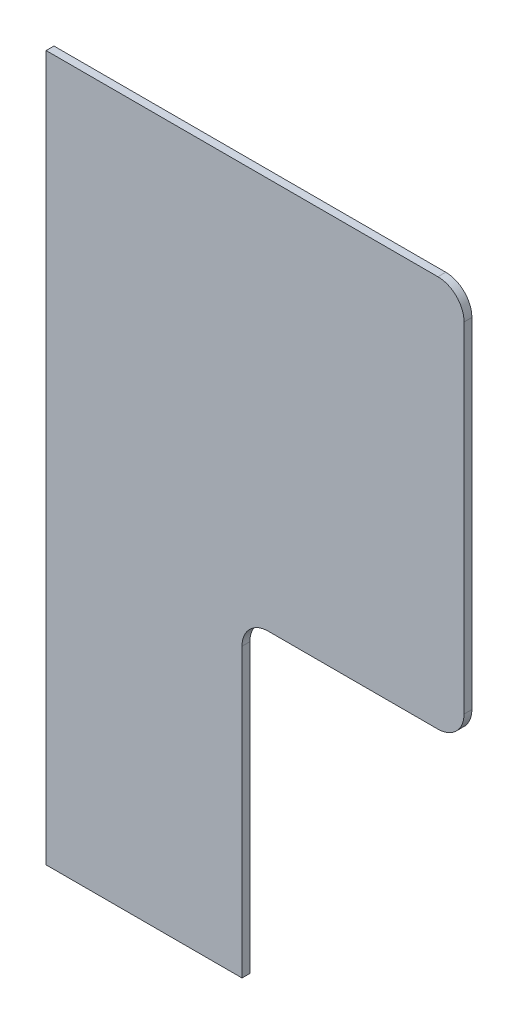
from build123d import *

# Parameters (mm, degrees)
BOSS_EXTRUDE1_DEPTH = 3


with BuildPart() as part:
    # Sketch1 → Boss-Extrude1 (new body)
    with BuildSketch(Plane.XY):
        with BuildLine():
            Line((-75, -120), (-75, 150))
            Line((-75, 150), (75, 150))
            ThreePointArc((75, 150), (82.071067812, 147.071067812), (85, 140))
            Line((85, 140), (85, 10))
            ThreePointArc((85, 10), (82.071067812, 2.928932188), (75, 0))
            Line((75, 0), (10, 0))
            ThreePointArc((10, 0), (2.928932188, -2.928932188), (0, -10))
            Line((0, -10), (0, -120))
            Line((0, -120), (-75, -120))
        make_face()
    extrude(amount=BOSS_EXTRUDE1_DEPTH)


solid = part.part
